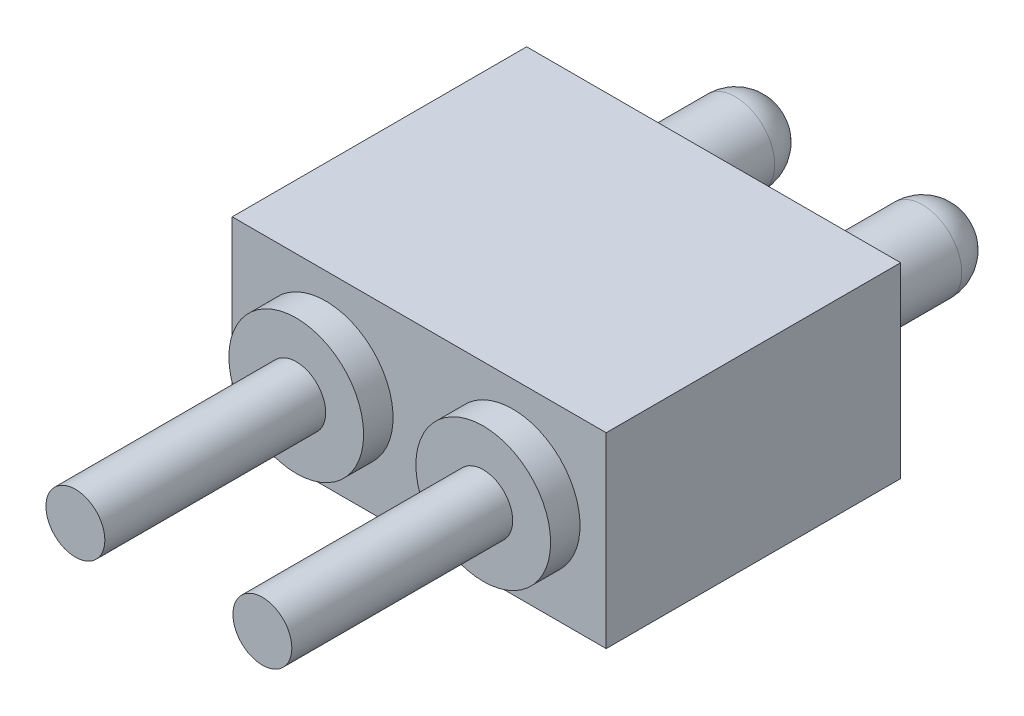
from build123d import *

# Parameters (mm, degrees)
ESQUISSE1_W       = 5.08
ESQUISSE1_H       = 2.54
EXTRUSION1_DEPTH  = 4
ESQUISSE2_R       = 0.915
EXTRUSION2_DEPTH  = 0.4
ESQUISSE3_R       = 0.535
EXTRUSION3_DEPTH  = 1.565
D_ME1_FACE_RADIUS = 0.535
D_ME1_HEIGHT      = 0.535
D_ME2_FACE_RADIUS = 0.535
D_ME2_HEIGHT      = 0.535
ESQUISSE4_R       = 0.4
EXTRUSION4_DEPTH  = 3


with BuildPart() as part:
    # Esquisse1 → Extrusion1 (new body)
    with BuildSketch(Plane.XY):
        with Locations((2.54, 1.27)):
            Rectangle(ESQUISSE1_W, ESQUISSE1_H)
    extrude(amount=EXTRUSION1_DEPTH)

    # Esquisse2 → Extrusion2 (add)
    with BuildSketch(Plane.XY.offset(4)):
        with Locations(Location((3.81, 1.27, 0), (0, 0, 180))):
            Circle(ESQUISSE2_R)
        with Locations(Location((1.27, 1.27, 0), (0, 0, 180))):
            Circle(ESQUISSE2_R)
    extrude(amount=EXTRUSION2_DEPTH)

    # Esquisse3 → Extrusion3 (add)
    with BuildSketch(Plane(origin=(0, 0, 0), x_dir=(-1, 0, 0), z_dir=(0, 0, -1))):
        with Locations((-3.81, 1.27)):
            Circle(ESQUISSE3_R)
        with Locations((-1.27, 1.27)):
            Circle(ESQUISSE3_R)
    extrude(amount=EXTRUSION3_DEPTH)

    # Dôme1: a dome of height H over a round flat face of radius A is a cap of a sphere of radius (A * A + H * H) / (2 * H)
    d_me1_r = (D_ME1_FACE_RADIUS * D_ME1_FACE_RADIUS + D_ME1_HEIGHT * D_ME1_HEIGHT) / (2 * D_ME1_HEIGHT)
    d_me1_base = Plane((3.81, 1.27, -1.565), z_dir=(0, 0, -1))
    with Locations(d_me1_base.offset(D_ME1_HEIGHT - d_me1_r)):
        d_me1_ball = Sphere(d_me1_r, mode=Mode.PRIVATE)
    add(split(d_me1_ball, bisect_by=d_me1_base, keep=Keep.TOP, mode=Mode.PRIVATE))

    # Dôme2: a dome of height H over a round flat face of radius A is a cap of a sphere of radius (A * A + H * H) / (2 * H)
    d_me2_r = (D_ME2_FACE_RADIUS * D_ME2_FACE_RADIUS + D_ME2_HEIGHT * D_ME2_HEIGHT) / (2 * D_ME2_HEIGHT)
    d_me2_base = Plane((1.27, 1.27, -1.565), z_dir=(0, 0, -1))
    with Locations(d_me2_base.offset(D_ME2_HEIGHT - d_me2_r)):
        d_me2_ball = Sphere(d_me2_r, mode=Mode.PRIVATE)
    add(split(d_me2_ball, bisect_by=d_me2_base, keep=Keep.TOP, mode=Mode.PRIVATE))

    # Esquisse4 → Extrusion4 (add)
    with BuildSketch(Plane.XY.offset(4.4)):
        with Locations((3.81, 1.27)):
            Circle(ESQUISSE4_R)
        with Locations((1.27, 1.27)):
            Circle(ESQUISSE4_R)
    extrude(amount=EXTRUSION4_DEPTH)


solid = part.part
